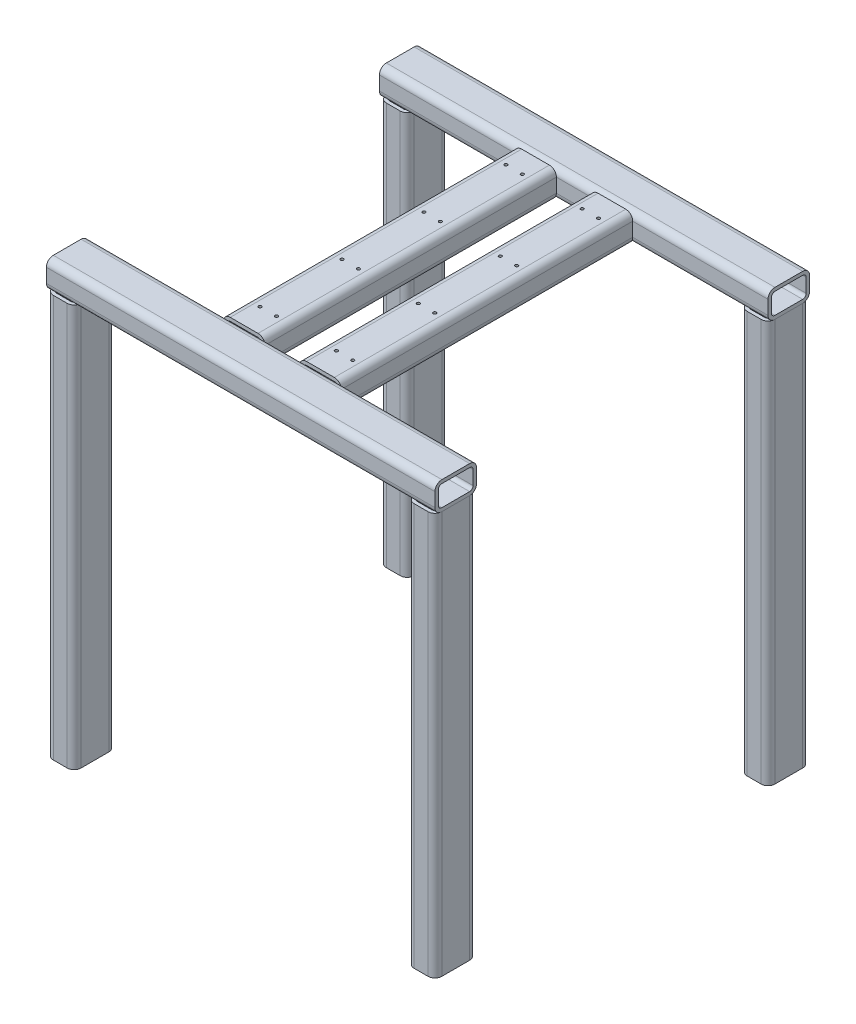
from build123d import *

# Parameters (mm, degrees)
RECTANGULAR_TUBE_CONFIGURED_3_X_2_X_0_DEPTH      = 685.799978029
RECTANGULAR_TUBE_CONFIGURED_3_X_2_X_0_DEPTH_BACK = 25.399978029
RECTANGULAR_TUBE_CONFIGURED_3_X_2_2_DEPTH        = 711.199956058
RECTANGULAR_TUBE_CONFIGURED_3_X_2_3_DEPTH        = 763
RECTANGULAR_TUBE_CONFIGURED_3_X_2_4_DEPTH        = 763
RECTANGULAR_TUBE_CONFIGURED_3_X_2_5_DEPTH        = 763
RECTANGULAR_TUBE_CONFIGURED_3_X_2_6_DEPTH        = 763
RECTANGULAR_TUBE_CONFIGURED_3_X_2_7_DEPTH        = 611.6
RECTANGULAR_TUBE_CONFIGURED_3_X_2_9_DEPTH        = 611.6
SKETCH2_R                                        = 2.75
CUT_EXTRUDE1_DEPTH                               = 1882.038040631


with BuildPart() as part:
    # Sketch1 → Rectangular tube - configured 3 X 2 X 0.25(1) (new, two sides: drawn at the far end of the back side and taken through both)
    with BuildSketch(Plane(origin=(868.841153909, 762, 60.393451308), x_dir=(0, 1, 0), z_dir=(1, 0, 0)).offset(-RECTANGULAR_TUBE_CONFIGURED_3_X_2_X_0_DEPTH_BACK)):
        with BuildLine():
            Line((-12.699978029, -38.1), (12.699978029, -38.1))
            ThreePointArc((12.699978029, -38.1), (21.68023415, -34.380256121), (25.399978029, -25.4))
            Line((25.399978029, -25.4), (25.399978029, 25.4))
            ThreePointArc((25.399978029, 25.4), (21.68023415, 34.380256121), (12.699978029, 38.1))
            Line((12.699978029, 38.1), (-12.699978029, 38.1))
            ThreePointArc((-12.699978029, 38.1), (-21.68023415, 34.380256121), (-25.399978029, 25.4))
            Line((-25.399978029, 25.4), (-25.399978029, -25.4))
            ThreePointArc((-25.399978029, -25.4), (-21.68023415, -34.380256121), (-12.699978029, -38.1))
        make_face()
        with BuildLine():
            Line((-12.699978029, -31.75), (12.699978029, -31.75))
            ThreePointArc((12.699978029, -31.75), (17.19010609, -29.890128061), (19.049978029, -25.4))
            Line((19.049978029, -25.4), (19.049978029, 25.4))
            ThreePointArc((19.049978029, 25.4), (17.19010609, 29.890128061), (12.699978029, 31.75))
            Line((12.699978029, 31.75), (-12.699978029, 31.75))
            ThreePointArc((-12.699978029, 31.75), (-17.19010609, 29.890128061), (-19.049978029, 25.4))
            Line((-19.049978029, 25.4), (-19.049978029, -25.4))
            ThreePointArc((-19.049978029, -25.4), (-17.19010609, -29.890128061), (-12.699978029, -31.75))
        make_face(mode=Mode.SUBTRACT)
    extrude(amount=RECTANGULAR_TUBE_CONFIGURED_3_X_2_X_0_DEPTH + RECTANGULAR_TUBE_CONFIGURED_3_X_2_X_0_DEPTH_BACK)


with BuildPart() as body_2:
    # Sketch1 on segment 2 (carried to segment 2) → Rectangular tube - configured 3 X 2  2 (new body)
    with BuildSketch(Plane(origin=(843.44117588, 762, 669.993451308), x_dir=(0, 1, 0), z_dir=(1, 0, 0))):
        with BuildLine():
            Line((-12.699978029, -38.1), (12.699978029, -38.1))
            ThreePointArc((12.699978029, -38.1), (21.68023415, -34.380256121), (25.399978029, -25.4))
            Line((25.399978029, -25.4), (25.399978029, 25.4))
            ThreePointArc((25.399978029, 25.4), (21.68023415, 34.380256121), (12.699978029, 38.1))
            Line((12.699978029, 38.1), (-12.699978029, 38.1))
            ThreePointArc((-12.699978029, 38.1), (-21.68023415, 34.380256121), (-25.399978029, 25.4))
            Line((-25.399978029, 25.4), (-25.399978029, -25.4))
            ThreePointArc((-25.399978029, -25.4), (-21.68023415, -34.380256121), (-12.699978029, -38.1))
        make_face()
        with BuildLine():
            Line((-12.699978029, -31.75), (12.699978029, -31.75))
            ThreePointArc((12.699978029, -31.75), (17.19010609, -29.890128061), (19.049978029, -25.4))
            Line((19.049978029, -25.4), (19.049978029, 25.4))
            ThreePointArc((19.049978029, 25.4), (17.19010609, 29.890128061), (12.699978029, 31.75))
            Line((12.699978029, 31.75), (-12.699978029, 31.75))
            ThreePointArc((-12.699978029, 31.75), (-17.19010609, 29.890128061), (-19.049978029, 25.4))
            Line((-19.049978029, 25.4), (-19.049978029, -25.4))
            ThreePointArc((-19.049978029, -25.4), (-17.19010609, -29.890128061), (-12.699978029, -31.75))
        make_face(mode=Mode.SUBTRACT)
    extrude(amount=RECTANGULAR_TUBE_CONFIGURED_3_X_2_2_DEPTH)


with BuildPart() as body_3:
    # Sketch1 on segment 3 (carried to segment 3) → Rectangular tube - configured 3 X 2  3 (new body)
    with BuildSketch(Plane(origin=(868.841153909, 0, 60.393451308), x_dir=(-1, 0, 0), z_dir=(0, 1, 0))):
        with BuildLine():
            Line((-12.699978029, -38.1), (12.699978029, -38.1))
            ThreePointArc((12.699978029, -38.1), (21.68023415, -34.380256121), (25.399978029, -25.4))
            Line((25.399978029, -25.4), (25.399978029, 25.4))
            ThreePointArc((25.399978029, 25.4), (21.68023415, 34.380256121), (12.699978029, 38.1))
            Line((12.699978029, 38.1), (-12.699978029, 38.1))
            ThreePointArc((-12.699978029, 38.1), (-21.68023415, 34.380256121), (-25.399978029, 25.4))
            Line((-25.399978029, 25.4), (-25.399978029, -25.4))
            ThreePointArc((-25.399978029, -25.4), (-21.68023415, -34.380256121), (-12.699978029, -38.1))
        make_face()
        with BuildLine():
            Line((-12.699978029, -31.75), (12.699978029, -31.75))
            ThreePointArc((12.699978029, -31.75), (17.19010609, -29.890128061), (19.049978029, -25.4))
            Line((19.049978029, -25.4), (19.049978029, 25.4))
            ThreePointArc((19.049978029, 25.4), (17.19010609, 29.890128061), (12.699978029, 31.75))
            Line((12.699978029, 31.75), (-12.699978029, 31.75))
            ThreePointArc((-12.699978029, 31.75), (-17.19010609, 29.890128061), (-19.049978029, 25.4))
            Line((-19.049978029, 25.4), (-19.049978029, -25.4))
            ThreePointArc((-19.049978029, -25.4), (-17.19010609, -29.890128061), (-12.699978029, -31.75))
        make_face(mode=Mode.SUBTRACT)
    extrude(amount=RECTANGULAR_TUBE_CONFIGURED_3_X_2_3_DEPTH)

    # Rectangular tube - configured 3 X 2 3 en
    split(bisect_by=Plane(origin=(868.841153909, 736.600021971, 60.393451308), x_dir=(1, 0, 0), z_dir=(0, -1, 0)), keep=Keep.TOP)


with BuildPart() as body_4:
    # Sketch1 on segment 4 (carried to segment 4) → Rectangular tube - configured 3 X 2  4 (new body)
    with BuildSketch(Plane(origin=(1529.241153909, 0, 669.993451308), x_dir=(-1, 0, 0), z_dir=(0, 1, 0))):
        with BuildLine():
            Line((-12.699978029, -38.1), (12.699978029, -38.1))
            ThreePointArc((12.699978029, -38.1), (21.68023415, -34.380256121), (25.399978029, -25.4))
            Line((25.399978029, -25.4), (25.399978029, 25.4))
            ThreePointArc((25.399978029, 25.4), (21.68023415, 34.380256121), (12.699978029, 38.1))
            Line((12.699978029, 38.1), (-12.699978029, 38.1))
            ThreePointArc((-12.699978029, 38.1), (-21.68023415, 34.380256121), (-25.399978029, 25.4))
            Line((-25.399978029, 25.4), (-25.399978029, -25.4))
            ThreePointArc((-25.399978029, -25.4), (-21.68023415, -34.380256121), (-12.699978029, -38.1))
        make_face()
        with BuildLine():
            Line((-12.699978029, -31.75), (12.699978029, -31.75))
            ThreePointArc((12.699978029, -31.75), (17.19010609, -29.890128061), (19.049978029, -25.4))
            Line((19.049978029, -25.4), (19.049978029, 25.4))
            ThreePointArc((19.049978029, 25.4), (17.19010609, 29.890128061), (12.699978029, 31.75))
            Line((12.699978029, 31.75), (-12.699978029, 31.75))
            ThreePointArc((-12.699978029, 31.75), (-17.19010609, 29.890128061), (-19.049978029, 25.4))
            Line((-19.049978029, 25.4), (-19.049978029, -25.4))
            ThreePointArc((-19.049978029, -25.4), (-17.19010609, -29.890128061), (-12.699978029, -31.75))
        make_face(mode=Mode.SUBTRACT)
    extrude(amount=RECTANGULAR_TUBE_CONFIGURED_3_X_2_4_DEPTH)

    # Rectangular tube - configured 3 X 2 4 en
    split(bisect_by=Plane(origin=(1529.241153909, 736.600021971, 669.993451308), x_dir=(1, 0, 0), z_dir=(0, -1, 0)), keep=Keep.TOP)


with BuildPart() as body_5:
    # Sketch1 on segment 5 (carried to segment 5) → Rectangular tube - configured 3 X 2  5 (new body)
    with BuildSketch(Plane(origin=(1529.241153909, 0, 60.393451308), x_dir=(-1, 0, 0), z_dir=(0, 1, 0))):
        with BuildLine():
            Line((-12.699978029, -38.1), (12.699978029, -38.1))
            ThreePointArc((12.699978029, -38.1), (21.68023415, -34.380256121), (25.399978029, -25.4))
            Line((25.399978029, -25.4), (25.399978029, 25.4))
            ThreePointArc((25.399978029, 25.4), (21.68023415, 34.380256121), (12.699978029, 38.1))
            Line((12.699978029, 38.1), (-12.699978029, 38.1))
            ThreePointArc((-12.699978029, 38.1), (-21.68023415, 34.380256121), (-25.399978029, 25.4))
            Line((-25.399978029, 25.4), (-25.399978029, -25.4))
            ThreePointArc((-25.399978029, -25.4), (-21.68023415, -34.380256121), (-12.699978029, -38.1))
        make_face()
        with BuildLine():
            Line((-12.699978029, -31.75), (12.699978029, -31.75))
            ThreePointArc((12.699978029, -31.75), (17.19010609, -29.890128061), (19.049978029, -25.4))
            Line((19.049978029, -25.4), (19.049978029, 25.4))
            ThreePointArc((19.049978029, 25.4), (17.19010609, 29.890128061), (12.699978029, 31.75))
            Line((12.699978029, 31.75), (-12.699978029, 31.75))
            ThreePointArc((-12.699978029, 31.75), (-17.19010609, 29.890128061), (-19.049978029, 25.4))
            Line((-19.049978029, 25.4), (-19.049978029, -25.4))
            ThreePointArc((-19.049978029, -25.4), (-17.19010609, -29.890128061), (-12.699978029, -31.75))
        make_face(mode=Mode.SUBTRACT)
    extrude(amount=RECTANGULAR_TUBE_CONFIGURED_3_X_2_5_DEPTH)

    # Rectangular tube - configured 3 X 2 5 en
    split(bisect_by=Plane(origin=(1529.241153909, 736.600021971, 60.393451308), x_dir=(1, 0, 0), z_dir=(0, -1, 0)), keep=Keep.TOP)


with BuildPart() as body_6:
    # Sketch1 on segment 6 (carried to segment 6) → Rectangular tube - configured 3 X 2  6 (new body)
    with BuildSketch(Plane(origin=(868.841153909, 0, 669.993451308), x_dir=(-1, 0, 0), z_dir=(0, 1, 0))):
        with BuildLine():
            Line((-12.699978029, -38.1), (12.699978029, -38.1))
            ThreePointArc((12.699978029, -38.1), (21.68023415, -34.380256121), (25.399978029, -25.4))
            Line((25.399978029, -25.4), (25.399978029, 25.4))
            ThreePointArc((25.399978029, 25.4), (21.68023415, 34.380256121), (12.699978029, 38.1))
            Line((12.699978029, 38.1), (-12.699978029, 38.1))
            ThreePointArc((-12.699978029, 38.1), (-21.68023415, 34.380256121), (-25.399978029, 25.4))
            Line((-25.399978029, 25.4), (-25.399978029, -25.4))
            ThreePointArc((-25.399978029, -25.4), (-21.68023415, -34.380256121), (-12.699978029, -38.1))
        make_face()
        with BuildLine():
            Line((-12.699978029, -31.75), (12.699978029, -31.75))
            ThreePointArc((12.699978029, -31.75), (17.19010609, -29.890128061), (19.049978029, -25.4))
            Line((19.049978029, -25.4), (19.049978029, 25.4))
            ThreePointArc((19.049978029, 25.4), (17.19010609, 29.890128061), (12.699978029, 31.75))
            Line((12.699978029, 31.75), (-12.699978029, 31.75))
            ThreePointArc((-12.699978029, 31.75), (-17.19010609, 29.890128061), (-19.049978029, 25.4))
            Line((-19.049978029, 25.4), (-19.049978029, -25.4))
            ThreePointArc((-19.049978029, -25.4), (-17.19010609, -29.890128061), (-12.699978029, -31.75))
        make_face(mode=Mode.SUBTRACT)
    extrude(amount=RECTANGULAR_TUBE_CONFIGURED_3_X_2_6_DEPTH)

    # Rectangular tube - configured 3 X 2 6 en
    split(bisect_by=Plane(origin=(868.841153909, 736.600021971, 669.993451308), x_dir=(1, 0, 0), z_dir=(0, -1, 0)), keep=Keep.TOP)


with BuildPart() as body_7:
    # Sketch1 on segment 7 (carried to segment 7) → Rectangular tube - configured 3 X 2  7 (new body)
    with BuildSketch(Plane(origin=(1129.191153909, 762, 59.393451308), x_dir=(0, 1, 0), z_dir=(0, 0, 1))):
        with BuildLine():
            Line((-12.699978029, -38.1), (12.699978029, -38.1))
            ThreePointArc((12.699978029, -38.1), (21.68023415, -34.380256121), (25.399978029, -25.4))
            Line((25.399978029, -25.4), (25.399978029, 25.4))
            ThreePointArc((25.399978029, 25.4), (21.68023415, 34.380256121), (12.699978029, 38.1))
            Line((12.699978029, 38.1), (-12.699978029, 38.1))
            ThreePointArc((-12.699978029, 38.1), (-21.68023415, 34.380256121), (-25.399978029, 25.4))
            Line((-25.399978029, 25.4), (-25.399978029, -25.4))
            ThreePointArc((-25.399978029, -25.4), (-21.68023415, -34.380256121), (-12.699978029, -38.1))
        make_face()
        with BuildLine():
            Line((-12.699978029, -31.75), (12.699978029, -31.75))
            ThreePointArc((12.699978029, -31.75), (17.19010609, -29.890128061), (19.049978029, -25.4))
            Line((19.049978029, -25.4), (19.049978029, 25.4))
            ThreePointArc((19.049978029, 25.4), (17.19010609, 29.890128061), (12.699978029, 31.75))
            Line((12.699978029, 31.75), (-12.699978029, 31.75))
            ThreePointArc((-12.699978029, 31.75), (-17.19010609, 29.890128061), (-19.049978029, 25.4))
            Line((-19.049978029, 25.4), (-19.049978029, -25.4))
            ThreePointArc((-19.049978029, -25.4), (-17.19010609, -29.890128061), (-12.699978029, -31.75))
        make_face(mode=Mode.SUBTRACT)
    extrude(amount=RECTANGULAR_TUBE_CONFIGURED_3_X_2_7_DEPTH)

    # Rectangular tube - configured 3 X 2 7 en
    split(bisect_by=Plane(origin=(1129.191153909, 762, 98.493451308), x_dir=(0, -1, 0), z_dir=(0, 0, 1)), keep=Keep.TOP)

    # Rectangular tube - configured 3 X 2  8
    split(bisect_by=Plane(origin=(1129.191153909, 762, 631.893451308), x_dir=(0, 1, 0), z_dir=(0, 0, -1)), keep=Keep.TOP)


with BuildPart() as body_8:
    # Sketch1 on segment 8 (carried to segment 8) → Rectangular tube - configured 3 X 2  9 (new body)
    with BuildSketch(Plane(origin=(1268.891153909, 762, 59.393451308), x_dir=(0, 1, 0), z_dir=(0, 0, 1))):
        with BuildLine():
            Line((-12.699978029, -38.1), (12.699978029, -38.1))
            ThreePointArc((12.699978029, -38.1), (21.68023415, -34.380256121), (25.399978029, -25.4))
            Line((25.399978029, -25.4), (25.399978029, 25.4))
            ThreePointArc((25.399978029, 25.4), (21.68023415, 34.380256121), (12.699978029, 38.1))
            Line((12.699978029, 38.1), (-12.699978029, 38.1))
            ThreePointArc((-12.699978029, 38.1), (-21.68023415, 34.380256121), (-25.399978029, 25.4))
            Line((-25.399978029, 25.4), (-25.399978029, -25.4))
            ThreePointArc((-25.399978029, -25.4), (-21.68023415, -34.380256121), (-12.699978029, -38.1))
        make_face()
        with BuildLine():
            Line((-12.699978029, -31.75), (12.699978029, -31.75))
            ThreePointArc((12.699978029, -31.75), (17.19010609, -29.890128061), (19.049978029, -25.4))
            Line((19.049978029, -25.4), (19.049978029, 25.4))
            ThreePointArc((19.049978029, 25.4), (17.19010609, 29.890128061), (12.699978029, 31.75))
            Line((12.699978029, 31.75), (-12.699978029, 31.75))
            ThreePointArc((-12.699978029, 31.75), (-17.19010609, 29.890128061), (-19.049978029, 25.4))
            Line((-19.049978029, 25.4), (-19.049978029, -25.4))
            ThreePointArc((-19.049978029, -25.4), (-17.19010609, -29.890128061), (-12.699978029, -31.75))
        make_face(mode=Mode.SUBTRACT)
    extrude(amount=RECTANGULAR_TUBE_CONFIGURED_3_X_2_9_DEPTH)

    # Rectangular tube - configured 3 X 2 9 en
    split(bisect_by=Plane(origin=(1268.891153909, 762, 98.493451308), x_dir=(0, -1, 0), z_dir=(0, 0, 1)), keep=Keep.TOP)

    # Rectangular tube - configured 3 X 2  10
    split(bisect_by=Plane(origin=(1268.891153909, 762, 631.893451308), x_dir=(0, 1, 0), z_dir=(0, 0, -1)), keep=Keep.TOP)


with BuildPart() as cut_extrude1_tool:
    # Sketch2 → Cut-Extrude1 (new, through all)
    with BuildSketch(Plane(origin=(0, 787.399978029, 0), x_dir=(1, 0, 0), z_dir=(0, 1, 0))):
        with Locations(Location((1114.191153909, -587.753323248, 0), (0, 0, 180))):
            Circle(SKETCH2_R)
        with Locations(Location((1144.191153909, -587.753323248, 0), (0, 0, 180))):
            Circle(SKETCH2_R)
        with Locations(Location((1114.191153909, -437.753323248, 0), (0, 0, 180))):
            Circle(SKETCH2_R)
        with Locations(Location((1144.191153909, -437.753323248, 0), (0, 0, 180))):
            Circle(SKETCH2_R)
        with Locations(Location((1114.191153909, -287.753323248, 0), (0, 0, 180))):
            Circle(SKETCH2_R)
        with Locations(Location((1144.191153909, -287.753323248, 0), (0, 0, 180))):
            Circle(SKETCH2_R)
        with Locations(Location((1114.191153909, -137.753323248, 0), (0, 0, 180))):
            Circle(SKETCH2_R)
        with Locations(Location((1144.191153909, -137.753323248, 0), (0, 0, 180))):
            Circle(SKETCH2_R)
        with Locations(Location((1253.891153909, -587.753323248, 0), (0, 0, 180))):
            Circle(SKETCH2_R)
        with Locations(Location((1283.891153909, -587.753323248, 0), (0, 0, 180))):
            Circle(SKETCH2_R)
        with Locations(Location((1253.891153909, -437.753323248, 0), (0, 0, 180))):
            Circle(SKETCH2_R)
        with Locations(Location((1283.891153909, -437.753323248, 0), (0, 0, 180))):
            Circle(SKETCH2_R)
        with Locations(Location((1253.891153909, -287.753323248, 0), (0, 0, 180))):
            Circle(SKETCH2_R)
        with Locations(Location((1283.891153909, -287.753323248, 0), (0, 0, 180))):
            Circle(SKETCH2_R)
        with Locations(Location((1253.891153909, -137.753323248, 0), (0, 0, 180))):
            Circle(SKETCH2_R)
        with Locations(Location((1283.891153909, -137.753323248, 0), (0, 0, 180))):
            Circle(SKETCH2_R)
    extrude(amount=-CUT_EXTRUDE1_DEPTH)


with BuildPart() as body_7_1:
    add(body_7.part)

    # Cut-Extrude1: cut by cut_extrude1_tool
    add(cut_extrude1_tool.part, mode=Mode.SUBTRACT)


with BuildPart() as body_8_1:
    add(body_8.part)

    # Cut-Extrude1: cut by cut_extrude1_tool
    add(cut_extrude1_tool.part, mode=Mode.SUBTRACT)


solid = Compound([part.part, body_2.part, body_3.part, body_4.part, body_5.part, body_6.part, body_7_1.part, body_8_1.part])
